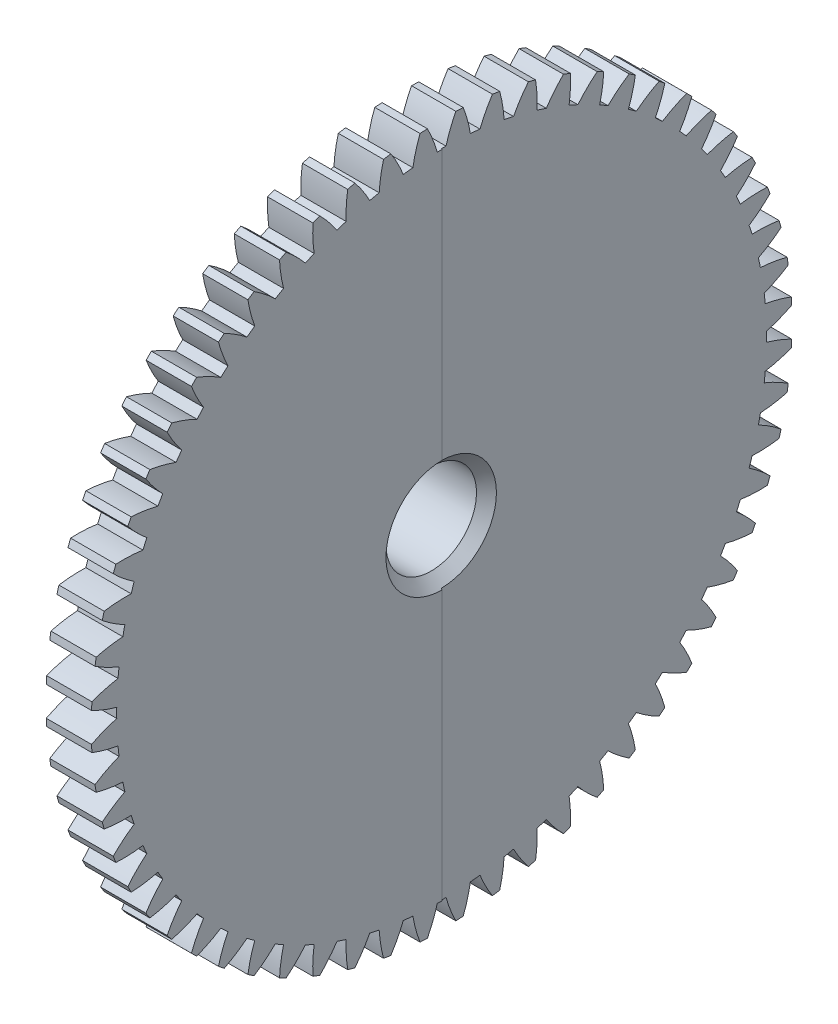
from build123d import *

# Parameters (mm, degrees)
BASPROSKE_W             = 6.35
BASPROSKE_H             = 49.2125
TOOTHCUT_DEPTH          = 70.886070232
TEETHCUTS_COUNT         = 60
TEETHCUTS_ANGLE         = 354
HUBNEAONESKE_R          = 15.875
HUBNEARONE_DEPTH        = 19.0500508
BORSKE_R                = 6.35
BORE_DEPTH              = 25.4000508
FILLET1_R               = 1.524
CHAMFER1_SIZE           = 1.524
CUT_EXTRUDE1_DEPTH      = 73.098368242
CUT_EXTRUDE1_DEPTH_BACK = 73.098368242
SKETCH1_R               = 2.38125
SKETCH2_W               = 52.589773658
SKETCH2_H               = 115.273553776
CUT_EXTRUDE2_DEPTH      = 0.127


with BuildPart() as part:
    # BasProSke → Base-Revolve (revolve)
    with BuildSketch(Plane(origin=(0, 0, 0), x_dir=(1, 0, 0), z_dir=(0, 1, 0)), mode=Mode.PRIVATE) as base_revolve_sk:
        with Locations((3.175, 24.60625)):
            Rectangle(BASPROSKE_W, BASPROSKE_H)
    revolve(base_revolve_sk.sketch.rotate(Axis((-10, 0, 0), (1, 0, 0)), 180), axis=Axis((-10, 0, 0), (1, 0, 0)))

    # TooCutSke → ToothCut (cut, through all)
    with BuildSketch(Plane(origin=(0, 0, 0), x_dir=(0, 0, -1), z_dir=(1, 0, 0))):
        with BuildLine():
            ThreePointArc((0.677629112, 45.634324183), (0, 45.639355), (-0.677629112, 45.634324183))
            ThreePointArc((-0.677629112, 45.634324183), (-1.284610751, 47.449364082), (-2.070645609, 49.194341373))
            ThreePointArc((-2.070645609, 49.194341373), (0, 49.2379), (2.070645609, 49.194341373))
            ThreePointArc((2.070645609, 49.194341373), (1.284610751, 47.449364082), (0.677629112, 45.634324183))
        make_face()
    toothcut = extrude(amount=TOOTHCUT_DEPTH, mode=Mode.SUBTRACT)

    # TeethCuts: ToothCut ×60 about axis
    teethcuts_axis = Axis((-10, 0, 0), (1, 0, 0))
    for i in range(1, TEETHCUTS_COUNT):
        add(toothcut.rotate(teethcuts_axis, i * TEETHCUTS_ANGLE / (TEETHCUTS_COUNT - 1)), mode=Mode.SUBTRACT)

    # HubNeaOneSke → HubNearOne (add)
    with BuildSketch(Plane.ZY):
        with Locations(Location((0, 0, 0), (0, 0, 180))):
            Circle(HUBNEAONESKE_R)
    extrude(amount=HUBNEARONE_DEPTH)

    # BorSke → Bore (cut, symmetric)
    with BuildSketch(Plane(origin=(0, 0, 0), x_dir=(0, 0, -1), z_dir=(1, 0, 0))):
        with Locations(Location((0, 0, 0), (0, 0, 180))):
            Circle(BORSKE_R)
    extrude(amount=BORE_DEPTH, both=True, mode=Mode.SUBTRACT)

    # Fillet1
    fillet1_edges = [part.edges().sort_by_distance(p)[0] for p in [
        (0, 0, 15.875),
        (-19.0500508, 0, 15.875),
    ]]
    fillet(fillet1_edges, radius=FILLET1_R)

    # Chamfer1
    chamfer1_edges = [part.edges().sort_by_distance(p)[0] for p in [
        (-19.0500508, 0, -6.35),
        (6.35, 0, -6.35),
    ]]
    chamfer(chamfer1_edges, length=CHAMFER1_SIZE)

    # Sketch1 → Cut-Extrude1 (cut, two sides: drawn at the far end of the back side and taken through both)
    with BuildSketch(Plane.XY.offset(-CUT_EXTRUDE1_DEPTH_BACK)):
        with Locations((-9.5250254, 0)):
            Circle(SKETCH1_R)
    extrude(amount=CUT_EXTRUDE1_DEPTH + CUT_EXTRUDE1_DEPTH_BACK, mode=Mode.SUBTRACT)

    # Sketch2 → Cut-Extrude2 (cut)
    with BuildSketch(Plane(origin=(6.35, 0, 0), x_dir=(0, 0, -1), z_dir=(1, 0, 0))):
        with Locations((26.294886829, 1.009400646)):
            Rectangle(SKETCH2_W, SKETCH2_H)
    extrude(amount=-CUT_EXTRUDE2_DEPTH, mode=Mode.SUBTRACT)


solid = part.part
